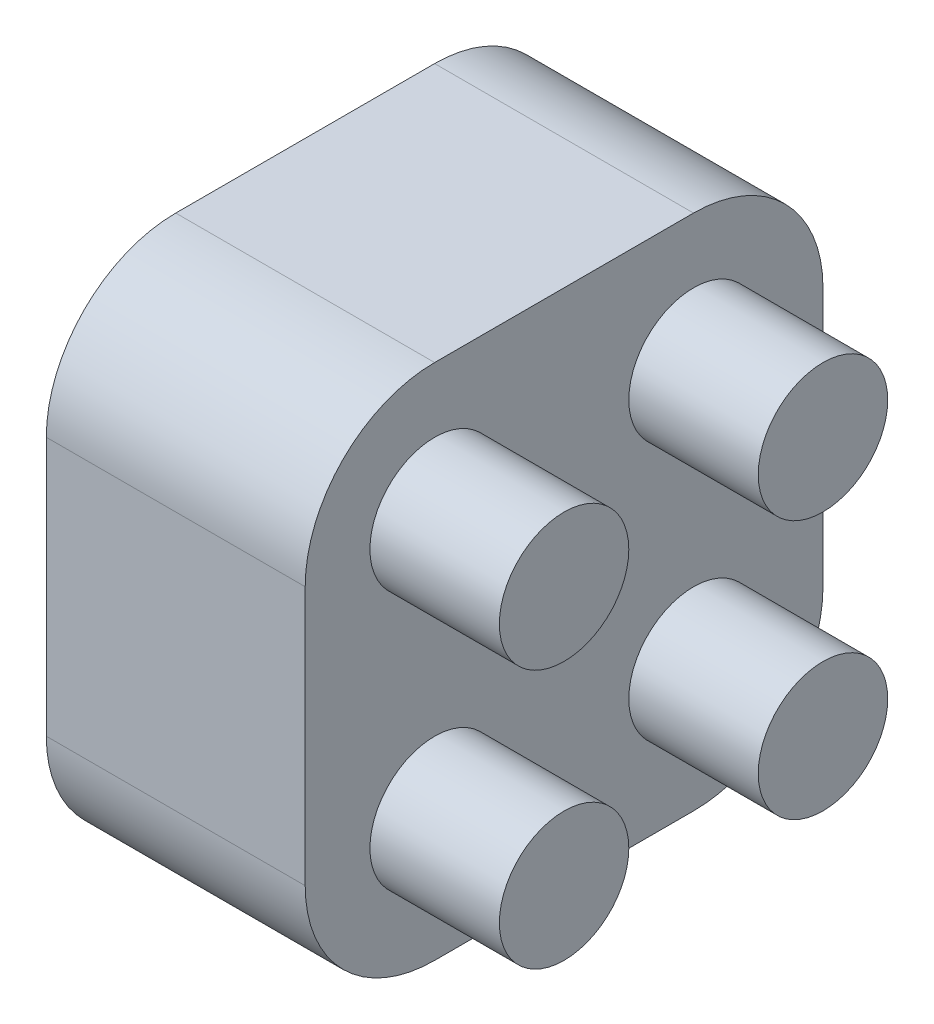
from build123d import *

# Parameters (mm, degrees)
SKETCH5_W           = 20
SKETCH5_H           = 20
BOSS_EXTRUDE1_DEPTH = 10
SKETCH6_R           = 2.5
BOSS_EXTRUDE2_DEPTH = 5
FILLET1_R           = 5
SHELL2_T            = -2


with BuildPart() as part:
    # Sketch5 → Boss-Extrude1 (new body)
    with BuildSketch(Plane(origin=(0, 0, 0), x_dir=(0, 0, -1), z_dir=(1, 0, 0))):
        with Locations((10, 10)):
            Rectangle(SKETCH5_W, SKETCH5_H)
    extrude(amount=BOSS_EXTRUDE1_DEPTH)

    # Sketch6 → Boss-Extrude2 (add)
    with BuildSketch(Plane(origin=(10, 0, 0), x_dir=(0, 0, -1), z_dir=(1, 0, 0))):
        with Locations(Location((5, 15, 0), (0, 0, 180))):
            Circle(SKETCH6_R)
        with Locations(Location((15, 15, 0), (0, 0, 180))):
            Circle(SKETCH6_R)
        with Locations(Location((15, 5, 0), (0, 0, 180))):
            Circle(SKETCH6_R)
        with Locations(Location((5, 5, 0), (0, 0, 180))):
            Circle(SKETCH6_R)
    extrude(amount=BOSS_EXTRUDE2_DEPTH)

    # Fillet1
    fillet1_edges = [part.edges().sort_by_distance(p)[0] for p in [
        (5, 20, 0),
        (5, 20, -20),
        (5, 0, -20),
        (5, 0, 0),
    ]]
    fillet(fillet1_edges, radius=FILLET1_R)

    # Shell2
    shell2_openings = [part.faces().sort_by_distance(p)[0] for p in [
        (0, 10, -10),
    ]]
    offset(amount=SHELL2_T, openings=shell2_openings, kind=Kind.INTERSECTION)


solid = part.part
